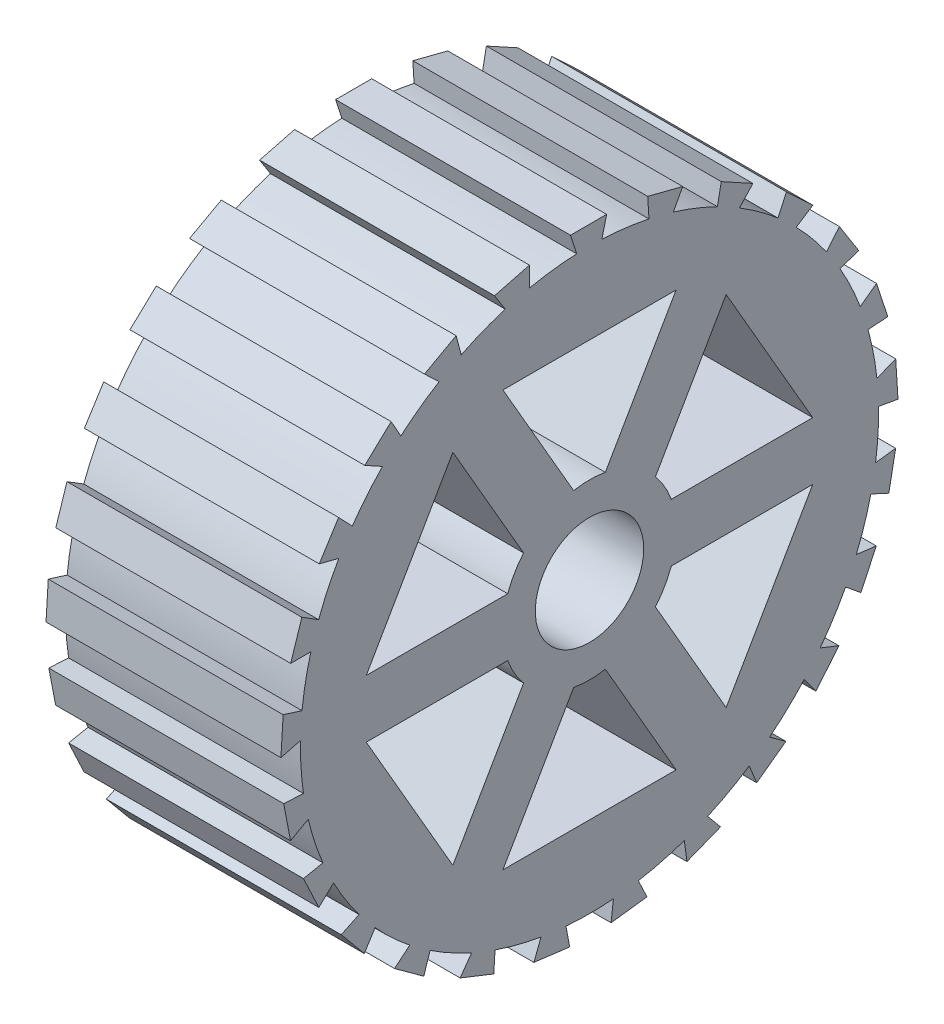
from build123d import *

# Parameters (mm, degrees)
SKETCH1_R           = 80
SKETCH1_R_2         = 15
BOSS_EXTRUDE1_DEPTH = 65
CUT_EXTRUDE1_DEPTH  = 65
BOSS_EXTRUDE2_DEPTH = 65


with BuildPart() as part:
    # Sketch1 → Boss-Extrude1 (new body)
    with BuildSketch(Plane(origin=(0, 0, 0), x_dir=(0, 0, -1), z_dir=(1, 0, 0))):
        Circle(SKETCH1_R)
        Circle(SKETCH1_R_2, mode=Mode.SUBTRACT)
    extrude(amount=BOSS_EXTRUDE1_DEPTH)

    # Sketch2 → Cut-Extrude1 (cut)
    with BuildSketch(Plane(origin=(65, 0, 0), x_dir=(0, 0, -1), z_dir=(1, 0, 0))):
        with BuildLine():
            Line((-37.816442632, 49.5), (-61.776478803, 8))
            Line((-61.776478803, 8), (-22.627416998, 8))
            ThreePointArc((-22.627416998, 8), (-20.784609691, 12), (-18.241911729, 15.595917942))
            Line((-18.241911729, 15.595917942), (-37.816442632, 49.5))
        make_face()
        with BuildLine():
            Line((-61.776478803, -8), (-37.816442632, -49.5))
            Line((-37.816442632, -49.5), (-18.241911729, -15.595917942))
            ThreePointArc((-18.241911729, -15.595917942), (-20.784609691, -12), (-22.627416998, -8))
            Line((-22.627416998, -8), (-61.776478803, -8))
        make_face()
        with BuildLine():
            Line((-4.385505269, -23.595917942), (-23.960036171, -57.5))
            Line((-23.960036171, -57.5), (23.960036171, -57.5))
            Line((23.960036171, -57.5), (4.385505269, -23.595917942))
            ThreePointArc((4.385505269, -23.595917942), (0, -24), (-4.385505269, -23.595917942))
        make_face()
        with BuildLine():
            Line((18.241911729, -15.595917942), (37.816442632, -49.5))
            Line((37.816442632, -49.5), (61.776478803, -8))
            Line((61.776478803, -8), (22.627416998, -8))
            ThreePointArc((22.627416998, -8), (20.784609691, -12), (18.241911729, -15.595917942))
        make_face()
        with BuildLine():
            Line((22.627416998, 8), (61.776478803, 8))
            Line((61.776478803, 8), (37.816442632, 49.5))
            Line((37.816442632, 49.5), (18.241911729, 15.595917942))
            ThreePointArc((18.241911729, 15.595917942), (20.784609691, 12), (22.627416998, 8))
        make_face()
        with BuildLine():
            Line((23.960036171, 57.5), (-23.960036171, 57.5))
            Line((-23.960036171, 57.5), (-4.385505269, 23.595917942))
            ThreePointArc((-4.385505269, 23.595917942), (0, 24), (4.385505269, 23.595917942))
            Line((4.385505269, 23.595917942), (23.960036171, 57.5))
        make_face()
    extrude(amount=-CUT_EXTRUDE1_DEPTH, mode=Mode.SUBTRACT)

    # Sketch3 → Boss-Extrude2 (add)
    with BuildSketch(Plane(origin=(65, 0, 0), x_dir=(0, 0, -1), z_dir=(1, 0, 0))):
        Polygon((-5.254935121, 85.241193332), (4.745064879, 85.241193332), (3.011443405, 78.241193332), (-2.988556595, 78.241193332), align=None)
        Polygon((22.374626914, 75.034186847), (25.794612692, 81.383134846), (16.108781081, 83.870033718), (16.563127947, 76.52632617), align=None)
        Polygon((40.331930326, 67.112506447), (45.223390123, 72.411474692), (36.460323323, 77.229011433), (35.074090246, 70.003028491), align=None)
        Polygon((55.755030225, 54.973900443), (61.810615633, 58.889935272), (54.520929359, 65.735406331), (51.381218461, 59.081183079), align=None)
        Polygon((67.674836523, 39.381082095), (74.514052839, 41.668124637), (69.15578489, 50.111403892), (64.459875753, 44.447049648), align=None)
        Polygon((75.342383951, 21.313805526), (82.535498062, 21.828152487), (79.445328118, 31.338717649), (73.488281984, 27.020144624), align=None)
        Polygon((78.275892305, 1.907304169), (85.370934397, 0.616637237), (84.743029202, 10.596904521), (77.899149188, 7.895464539), align=None)
        Polygon((76.291038468, -17.619040124), (82.842200952, -20.633623598), (84.716014098, -10.810751091), (77.415326355, -11.72531662), align=None)
        Polygon((69.512538104, -36.038315328), (75.108187348, -40.587397978), (79.365980264, -31.539127453), (72.067213854, -30.609353013), align=None)
        Polygon((58.366309323, -52.19317064), (62.654850105, -57.990916872), (69.029090003, -50.285784444), (62.190853261, -47.570091183), align=None)
        Polygon((43.55271067, -65.068537087), (46.264678201, -71.750653184), (54.354848145, -65.872800661), (48.406812636, -61.541825573), align=None)
        Polygon((26.00253503, -73.855408044), (26.967526417, -81.002032075), (36.265291276, -77.320786548), (31.581193946, -71.646660728), align=None)
        Polygon((6.818524484, -78.001672092), (5.975905768, -85.163755387), (15.897052781, -83.910423051), (12.771212692, -77.249672691), align=None)
        Polygon((-12.793919032, -77.246804213), (-15.391203019, -83.974326737), (-5.470056006, -85.227659073), (-6.841230825, -77.998803615), align=None)
        Polygon((-31.602473563, -71.638235531), (-35.791225914, -77.508482303), (-26.493461056, -81.18972783), (-26.023814648, -73.846982847), align=None)
        Polygon((-48.425328454, -61.528373044), (-53.942354455, -66.172494869), (-45.852184511, -72.050347392), (-43.571226488, -65.055084558), align=None)
        Polygon((-62.205441863, -47.552456593), (-68.704086479, -50.678646217), (-62.329846582, -58.383778645), (-58.380897924, -52.175536049), align=None)
        Polygon((-72.076958583, -30.588644408), (-79.148888074, -32.00047184), (-74.891095158, -41.048742365), (-69.522282834, -36.017606723), align=None)
        Polygon((-77.419614916, -11.702835198), (-84.620473942, -11.311590128), (-82.746660796, -21.134462636), (-76.295327028, -17.596558703), align=None)
        Polygon((-77.897712113, 7.918306187), (-84.775044219, 10.088040392), (-85.402949415, 0.107773108), (-78.27445523, 1.930145817), align=None)
        Polygon((-73.481209571, 27.041911273), (-79.602886688, 30.853802234), (-82.693056632, 21.343237071), (-75.335311537, 21.335572176), align=None)
        Polygon((-64.447612387, 44.466373621), (-69.428987027, 49.680906209), (-74.787254977, 41.237626954), (-67.662573157, 39.400406068), align=None)
        Polygon((-51.364534694, 59.096850178), (-54.892608769, 65.386376133), (-62.182295043, 58.540905074), (-55.738346459, 54.989567543), align=None)
        Polygon((-35.054034381, 70.014054296), (-36.907126021, 76.983379571), (-45.670192822, 72.16584283), (-40.311874462, 67.123532251), align=None)
        Polygon((-16.540960169, 76.532017888), (-16.602632811, 83.743234145), (-26.288464422, 81.256335273), (-22.352459135, 75.039878565), align=None)
    extrude(amount=-BOSS_EXTRUDE2_DEPTH)


solid = part.part
